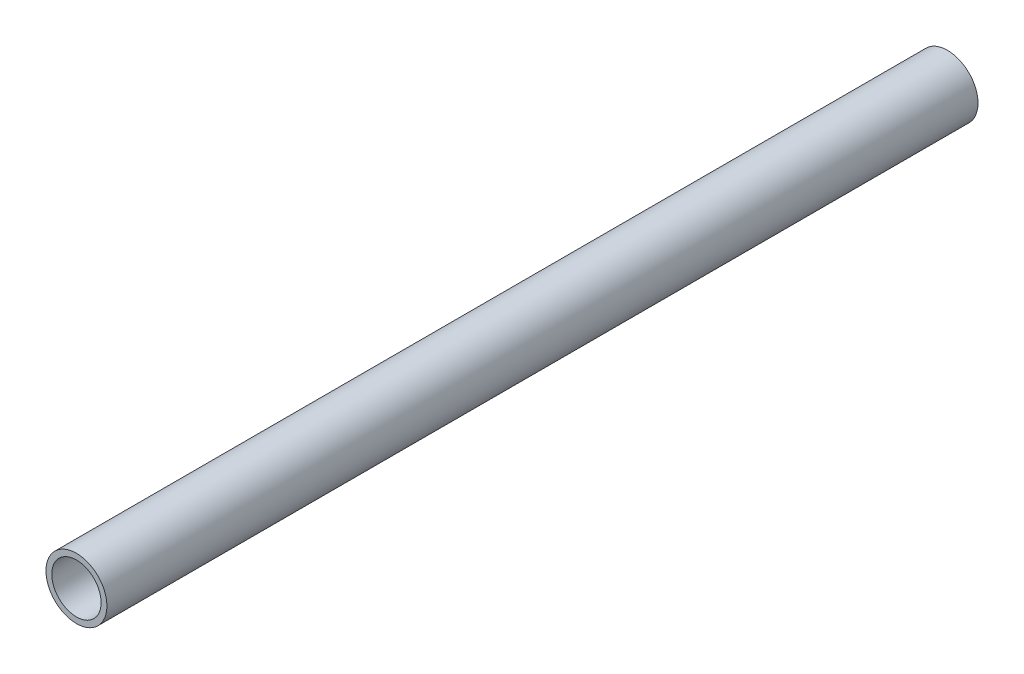
from build123d import *

# Parameters (mm, degrees)
SKETCH1_R           = 8.001
SKETCH1_R_2         = 6.477
BOSS_EXTRUDE1_DEPTH = 228.6


with BuildPart() as part:
    # Sketch1 → Boss-Extrude1 (new body)
    with BuildSketch(Plane.XY):
        Circle(SKETCH1_R)
        Circle(SKETCH1_R_2, mode=Mode.SUBTRACT)
    extrude(amount=BOSS_EXTRUDE1_DEPTH)


solid = part.part
